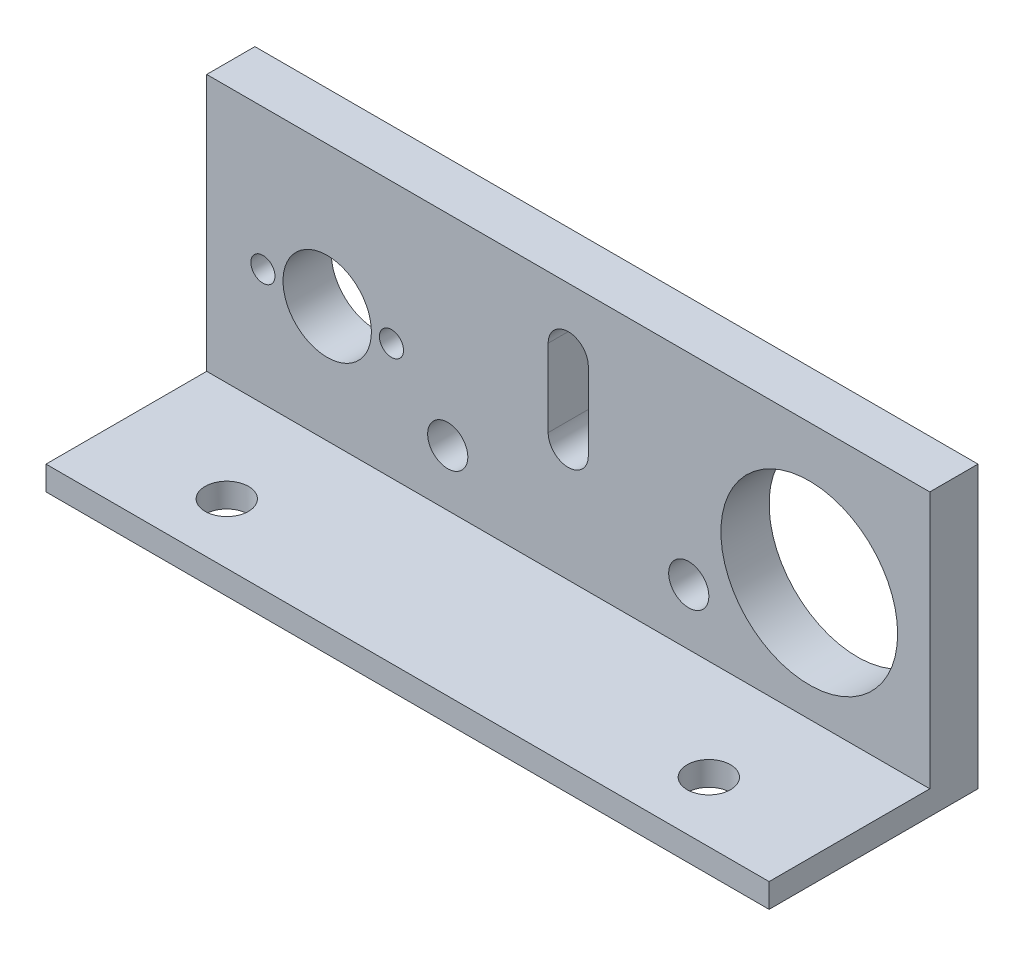
from build123d import *

# Parameters (mm, degrees)
SKETCH1_W           = 90
SKETCH1_H           = 35
SKETCH1_R           = 5.5
SKETCH1_R_2         = 1.5
SKETCH1_R_3         = 11
BOSS_EXTRUDE1_DEPTH = 6
SKETCH2_W           = 90
SKETCH2_H           = 3
BOSS_EXTRUDE2_DEPTH = 20
SKETCH4_R           = 2.5
CUT_EXTRUDE1_DEPTH  = 10
SKETCH5_R           = 2.7
CUT_EXTRUDE2_DEPTH  = 10


with BuildPart() as part:
    # Sketch1 → Boss-Extrude1 (new body)
    with BuildSketch(Plane.XY):
        Rectangle(SKETCH1_W, SKETCH1_H)
        with Locations((-30, 0)):
            Circle(SKETCH1_R, mode=Mode.SUBTRACT)
        with Locations((-38, 0)):
            Circle(SKETCH1_R_2, mode=Mode.SUBTRACT)
        with Locations((-22, 0)):
            Circle(SKETCH1_R_2, mode=Mode.SUBTRACT)
        with Locations((29.999666666, 0.2)):
            Circle(SKETCH1_R_3, mode=Mode.SUBTRACT)
    extrude(amount=BOSS_EXTRUDE1_DEPTH)

    # Sketch2 → Boss-Extrude2 (add)
    with BuildSketch(Plane.XY.offset(6)):
        with Locations((0, -16)):
            Rectangle(SKETCH2_W, SKETCH2_H)
    extrude(amount=BOSS_EXTRUDE2_DEPTH)

    # Sketch4 → Cut-Extrude1 (cut)
    with BuildSketch(Plane.XY.offset(6)):
        with Locations((15, -7.5)):
            Circle(SKETCH4_R)
        with Locations(Location((-15, -7.5, 0), (0, 0, 180))):
            Circle(SKETCH4_R)
        with BuildLine():
            Line((2.5, 9.778989608), (2.5, 0.141519694))
            ThreePointArc((2.5, 0.141519694), (0, -2.358480306), (-2.5, 0.141519694))
            Line((-2.5, 0.141519694), (-2.5, 9.778989608))
            ThreePointArc((-2.5, 9.778989608), (0, 12.278989608), (2.5, 9.778989608))
        make_face()
    extrude(amount=-CUT_EXTRUDE1_DEPTH, mode=Mode.SUBTRACT)

    # Sketch5 → Cut-Extrude2 (cut)
    with BuildSketch(Plane(origin=(0, -14.5, 0), x_dir=(1, 0, 0), z_dir=(0, 1, 0))):
        with Locations(Location((30, -18.5, 0), (0, 0, 270))):
            Circle(SKETCH5_R)
        with Locations(Location((-30, -18.5, 0), (0, 0, 270))):
            Circle(SKETCH5_R)
    extrude(amount=-CUT_EXTRUDE2_DEPTH, mode=Mode.SUBTRACT)


solid = part.part
